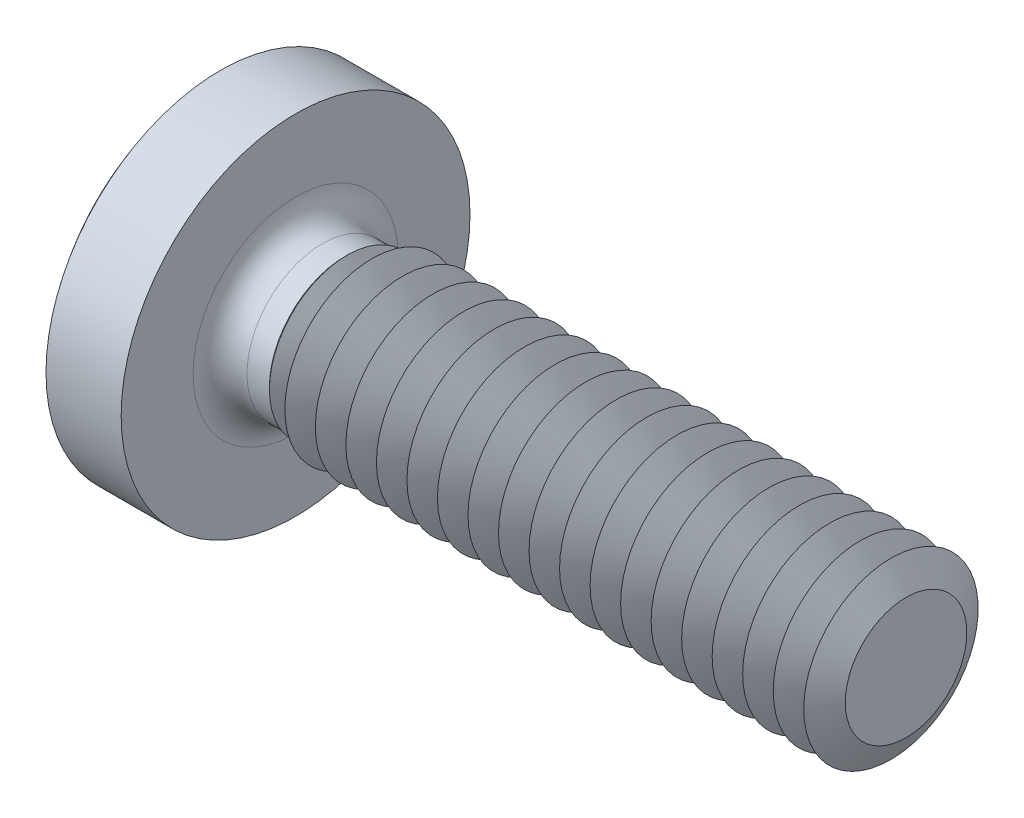
from build123d import *

# Parameters (mm, degrees)
PATTERN_LINEAR_1_COUNT = 19
PATTERN_LINEAR_1_PITCH = 0.7


with BuildPart() as part:
    # 草图2 → Revolve 706 (revolve)
    with BuildSketch(Plane.XY, mode=Mode.PRIVATE) as revolve_706_sk:
        with BuildLine():
            Line((0, 0), (17.1, 0))
            Line((17.1, 0), (17.1, 2))
            Line((17.1, 2), (4.5, 2))
            Line((4.5, 2), (4.232, 1.732))
            Line((4.232, 1.732), (3.718, 1.732))
            ThreePointArc((3.718, 1.732), (3.281008009, 1.913008009), (3.1, 2.35))
            Line((3.1, 2.35), (3.1, 4))
            Line((3.1, 4), (1.376524617, 4))
            ThreePointArc((1.376524617, 4), (0.353757652, 2.115113473), (0, 0))
        make_face()
    revolve(revolve_706_sk.sketch.rotate(Axis((-1.331757704, 0, 0), (1, 0, 0)), 90), axis=Axis((-1.331757704, 0, 0), (1, 0, 0)))

    # 草图3 → 切除-旋转1 (revolve, cut)
    with BuildSketch(Plane.XY, mode=Mode.PRIVATE) as cut_revolve_1_sk:
        Polygon((16.753791204, 2), (17.453791204, 2), (17.1, 1.3938), align=None)
    cut_revolve_1 = revolve(cut_revolve_1_sk.sketch.rotate(Axis((-0.242766179, 0, 0), (1, 0, 0)), 90), axis=Axis((-0.242766179, 0, 0), (1, 0, 0)), mode=Mode.SUBTRACT)

    # 阵列(线性)1: 切除-旋转1 ×19
    with Locations(*[(-i * PATTERN_LINEAR_1_PITCH, 0, 0) for i in range(1, PATTERN_LINEAR_1_COUNT)]):
        add(cut_revolve_1, mode=Mode.SUBTRACT)

    # 草图5 → 切除-放样1 section 0
    with BuildSketch(Plane(origin=(0, 0, 0), x_dir=(0, 0, -1), z_dir=(1, 0, 0)), mode=Mode.PRIVATE) as loft_1_s0:
        with BuildLine():
            Line((0.35, 2.2), (-0.35, 2.2))
            Line((-0.35, 2.2), (-0.35, -2.2))
            Line((-0.35, -2.2), (0.35, -2.2))
            Line((0.35, -2.2), (0.35, 2.2))
        make_face()
    loft_1 = loft([Vertex(2.4, 0, 0), loft_1_s0.sketch], mode=Mode.SUBTRACT)

    # 镜向1: 切除-放样1 across plane
    add(loft_1.mirror(Plane(origin=(0, 0, 0), x_dir=(0, 0.7071067811865462, 0.7071067811865488), z_dir=(0, -0.7071067811865488, 0.7071067811865462))), mode=Mode.SUBTRACT)


solid = part.part
